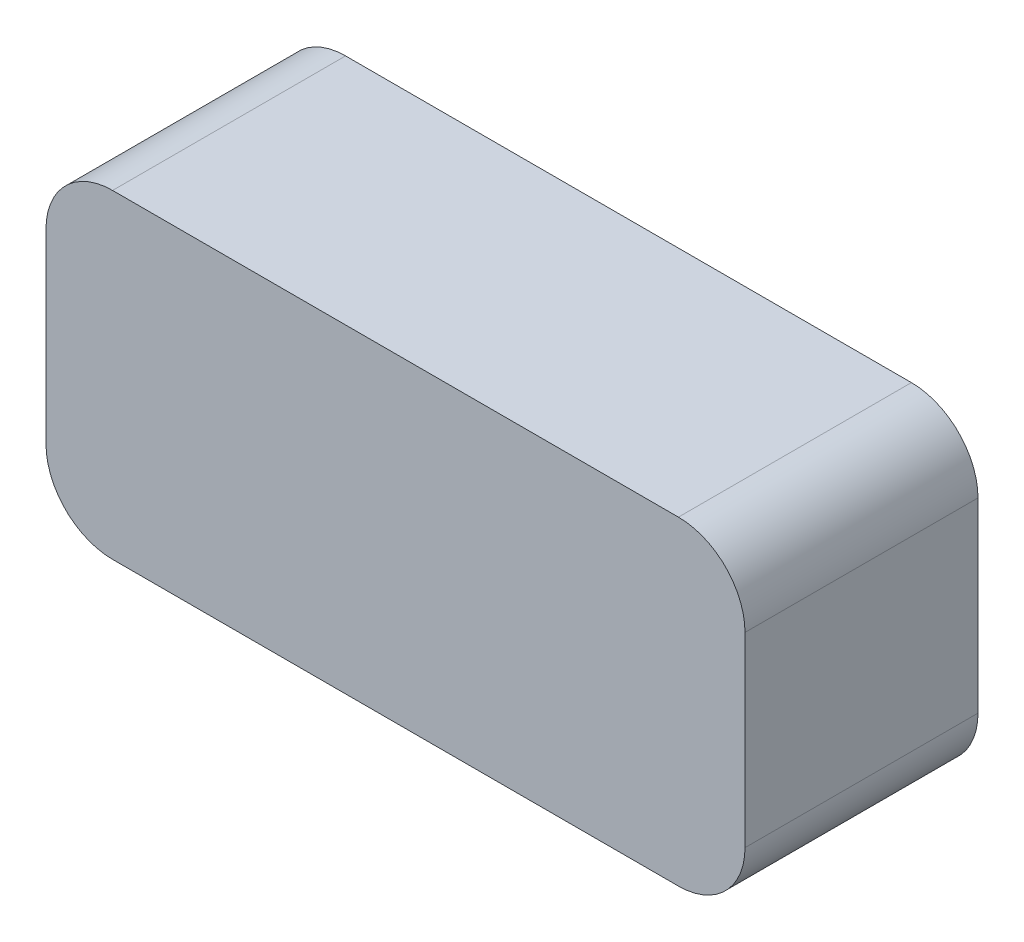
from build123d import *

# Parameters (mm, degrees)
F_01_CAPTURED_TAIL_BUTTON_DEPTH = 7


with BuildPart() as part:
    # S01 - Captured tail button → 01 - Captured tail button (new body)
    with BuildSketch(Plane.XY):
        with BuildLine():
            Line((-8.5, -5), (8.5, -5))
            ThreePointArc((8.5, -5), (9.914213562, -4.414213562), (10.5, -3))
            Line((10.5, -3), (10.5, 2.6))
            ThreePointArc((10.5, 2.6), (9.914213562, 4.014213562), (8.5, 4.6))
            Line((8.5, 4.6), (-8.5, 4.6))
            ThreePointArc((-8.5, 4.6), (-9.914213562, 4.014213562), (-10.5, 2.6))
            Line((-10.5, 2.6), (-10.5, -3))
            ThreePointArc((-10.5, -3), (-9.914213562, -4.414213562), (-8.5, -5))
        make_face()
    extrude(amount=F_01_CAPTURED_TAIL_BUTTON_DEPTH)


solid = part.part
